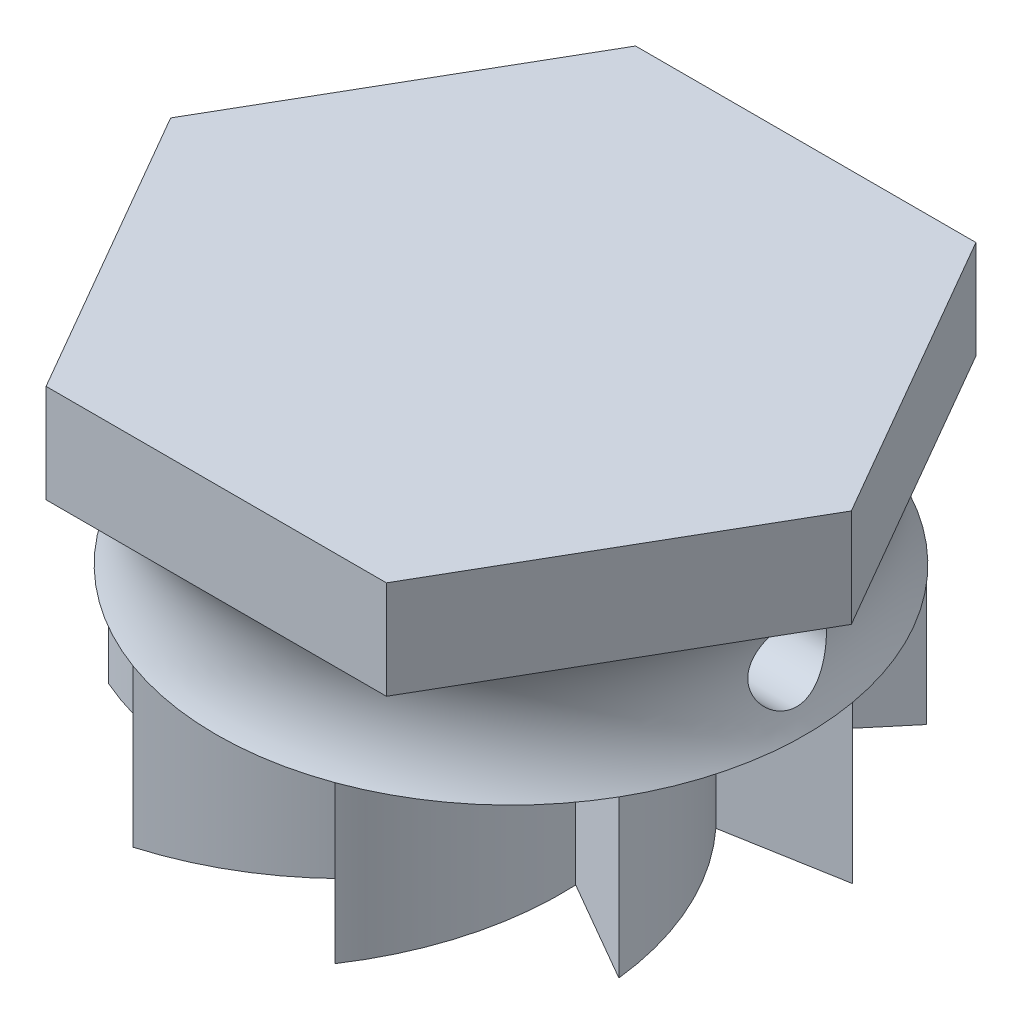
from build123d import *

# Parameters (mm, degrees)
SKETCH1_R                = 3.025
BOSS_EXTRUDE1_DEPTH      = 4
BOSS_EXTRUDE2_DEPTH      = 3
BOSS_EXTRUDE2_DEPTH_BACK = 0.01
SKETCH2_R                = 7.5
BOSS_EXTRUDE3_DEPTH      = 2.5
CUT_EXTRUDE1_DEPTH       = 15.882876066
CUT_EXTRUDE1_DEPTH_BACK  = 15.882876066
SKETCH4_R                = 1


with BuildPart() as part:
    # Sketch1 → Boss-Extrude1 (new body)
    with BuildSketch(Plane(origin=(0, 0, 0), x_dir=(1, 0, 0), z_dir=(0, 1, 0))):
        with BuildLine():
            ThreePointArc((4.820907073, 5.745333323), (2.311100785, 5.507278856), (0, 4.5))
            Line((0, 4.5), (0, 7.5))
            ThreePointArc((0, 7.5), (-1.769604698, 5.704367313), (-2.892544244, 3.447199994))
            Line((-2.892544244, 3.447199994), (-4.820907073, 5.745333323))
            ThreePointArc((-4.820907073, 5.745333323), (-5.022292475, 3.232318908), (-4.431634889, 0.7814168))
            Line((-4.431634889, 0.7814168), (-7.386058148, 1.302361333))
            ThreePointArc((-7.386058148, 1.302361333), (-5.924993787, -0.752167437), (-3.897114317, -2.25))
            Line((-3.897114317, -2.25), (-6.495190528, -3.75))
            ThreePointArc((-6.495190528, -3.75), (-4.055324657, -4.384706279), (-1.539090645, -4.228616794))
            Line((-1.539090645, -4.228616794), (-2.565151075, -7.047694656))
            ThreePointArc((-2.565151075, -7.047694656), (-0.28812405, -5.965592323), (1.539090645, -4.228616794))
            Line((1.539090645, -4.228616794), (2.565151075, -7.047694656))
            ThreePointArc((2.565151075, -7.047694656), (3.613893002, -4.755111418), (3.897114317, -2.25))
            Line((3.897114317, -2.25), (6.495190528, -3.75))
            ThreePointArc((6.495190528, -3.75), (5.824929355, -1.319661034), (4.431634889, 0.7814168))
            Line((4.431634889, 0.7814168), (7.386058148, 1.302361333))
            ThreePointArc((7.386058148, 1.302361333), (5.310416525, 2.733273415), (2.892544244, 3.447199994))
            Line((2.892544244, 3.447199994), (4.820907073, 5.745333323))
        make_face()
        Circle(SKETCH1_R, mode=Mode.SUBTRACT)
    extrude(amount=BOSS_EXTRUDE1_DEPTH)

    # Sketch2 → Boss-Extrude2 (add, two sides: drawn at the far end of the back side and taken through both)
    with BuildSketch(Plane(origin=(0, 4, 0), x_dir=(1, 0, 0), z_dir=(0, 1, 0)).offset(-BOSS_EXTRUDE2_DEPTH_BACK)):
        Circle(SKETCH2_R)
    extrude(amount=BOSS_EXTRUDE2_DEPTH + BOSS_EXTRUDE2_DEPTH_BACK)

    # Sketch3 → Boss-Extrude3 (add)
    with BuildSketch(Plane(origin=(0, 7, 0), x_dir=(1, 0, 0), z_dir=(0, 1, 0))):
        Polygon((4.330127019, 7.5), (-4.330127019, 7.5), (-8.660254038, 0), (-4.330127019, -7.5), (4.330127019, -7.5), (8.660254038, 0), align=None)
    extrude(amount=BOSS_EXTRUDE3_DEPTH)

    # Sketch4 → Cut-Extrude1 (cut, two sides: drawn at the far end of the back side and taken through both)
    with BuildSketch(Plane(origin=(0, 0, 0), x_dir=(0, 0, -1), z_dir=(1, 0, 0)).offset(-CUT_EXTRUDE1_DEPTH_BACK)):
        with Locations((0, 5.49)):
            Circle(SKETCH4_R)
    extrude(amount=CUT_EXTRUDE1_DEPTH + CUT_EXTRUDE1_DEPTH_BACK, mode=Mode.SUBTRACT)

    # Cut-Sweep1: sweep along a path in Sketch2<2>
    with BuildLine(Plane(origin=(0, 4, 0), x_dir=(1, 0, 0), z_dir=(0, 1, 0))) as cut_sweep1_path:
        CenterArc((0, 0), 7.5, 0, 360)
    # Sketch5 → Cut-Sweep1 (sweep, cut)
    with BuildSketch(Plane(origin=(0, 0, 0), x_dir=(0, 0, -1), z_dir=(1, 0, 0))):
        with BuildLine():
            Line((7.5, 7), (7.5, 3.99))
            ThreePointArc((7.5, 3.99), (7.095183038, 5.495), (7.5, 7))
        make_face()
    sweep(path=cut_sweep1_path.line, mode=Mode.SUBTRACT)


solid = part.part
